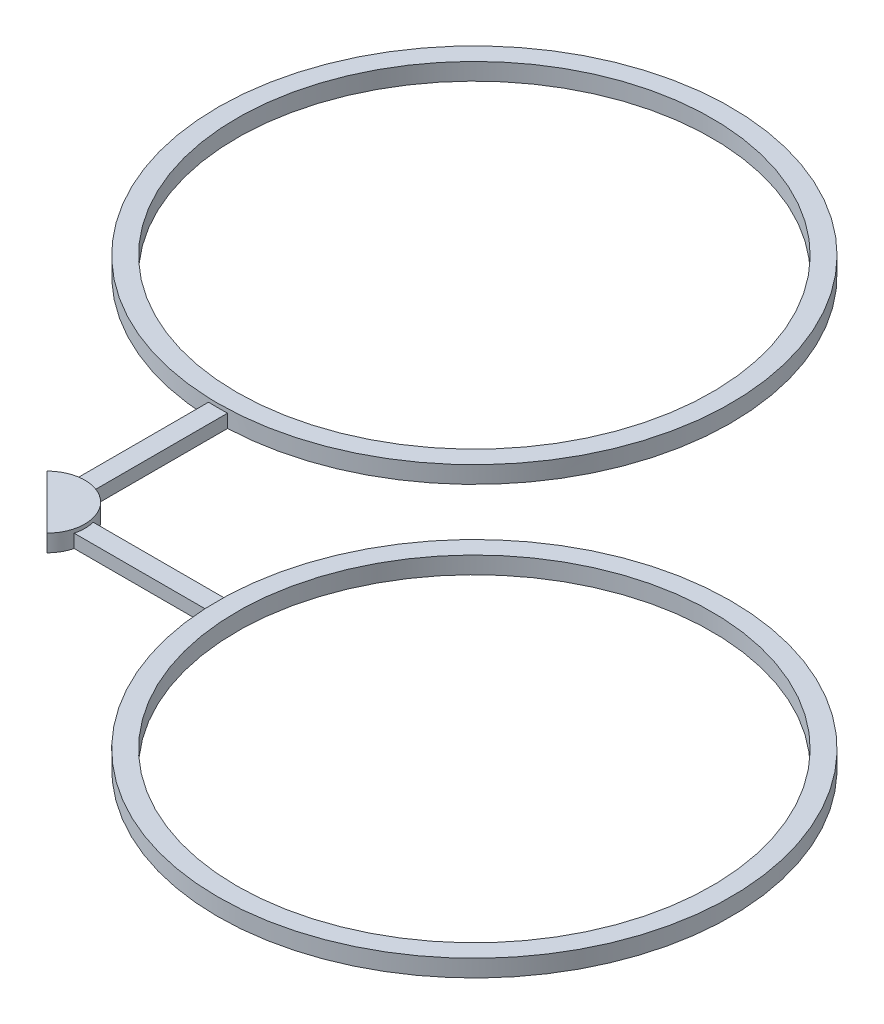
from build123d import *

# Parameters (mm, degrees)
BOSS_EXTRUDE1_DEPTH   = 1.8
SKETCH1_R             = 27
SKETCH1_R_2           = 25
BOSS_EXTRUDE1_2_DEPTH = 1.8
BOSS_EXTRUDE1_3_DEPTH = 1.8
BOSS_EXTRUDE2_DEPTH   = 1.4


with BuildPart() as part:
    # Sketch1 → Boss-Extrude1 (new body)
    with BuildSketch(Plane(origin=(0, 0, 0), x_dir=(1, 0, 0), z_dir=(0, 1, 0))):
        with BuildLine():
            ThreePointArc((2.828427125, -2.828427125), (2.828427125, 2.828427125), (-2.828427125, 2.828427125))
            Line((-2.828427125, 2.828427125), (2.828427125, -2.828427125))
        make_face()
    extrude(amount=BOSS_EXTRUDE1_DEPTH)



with BuildPart() as body_2:
    # Sketch1 → Boss-Extrude1 2 (new body)
    with BuildSketch(Plane(origin=(0, 0, 0), x_dir=(1, 0, 0), z_dir=(0, 1, 0))):
        with Locations((0, 45)):
            Circle(SKETCH1_R)
        with Locations((0, 45)):
            Circle(SKETCH1_R_2, mode=Mode.SUBTRACT)
    extrude(amount=BOSS_EXTRUDE1_2_DEPTH)


with BuildPart() as body_3:
    # Sketch1 → Boss-Extrude1 3 (new body)
    with BuildSketch(Plane(origin=(0, 0, 0), x_dir=(1, 0, 0), z_dir=(0, 1, 0))):
        with Locations((45, 0)):
            Circle(SKETCH1_R)
        with Locations((45, 0)):
            Circle(SKETCH1_R_2, mode=Mode.SUBTRACT)
    extrude(amount=BOSS_EXTRUDE1_3_DEPTH)


with BuildPart() as part_1:
    add(part.part)

    add(body_2.part)  # Boss-Extrude2 merges body 2

    add(body_3.part)  # Boss-Extrude2 merges body 3
    # Sketch1<3> → Boss-Extrude2 (add)
    with BuildSketch(Plane(origin=(0, 0, 0), x_dir=(1, 0, 0), z_dir=(0, 1, 0))):
        with BuildLine():
            Line((-1, 18.018524874), (-1, 3.872983346))
            ThreePointArc((-1, 3.872983346), (0, 4), (1, 3.872983346))
            Line((1, 3.872983346), (1, 18.018524874))
            ThreePointArc((1, 18.018524874), (0, 18), (-1, 18.018524874))
        make_face()
        with BuildLine():
            ThreePointArc((3.872983346, 1), (4, 0), (3.872983346, -1))
            Line((3.872983346, -1), (18.018524874, -1))
            ThreePointArc((18.018524874, -1), (18, 0), (18.018524874, 1))
            Line((18.018524874, 1), (3.872983346, 1))
        make_face()
    extrude(amount=BOSS_EXTRUDE2_DEPTH)


solid = part_1.part
